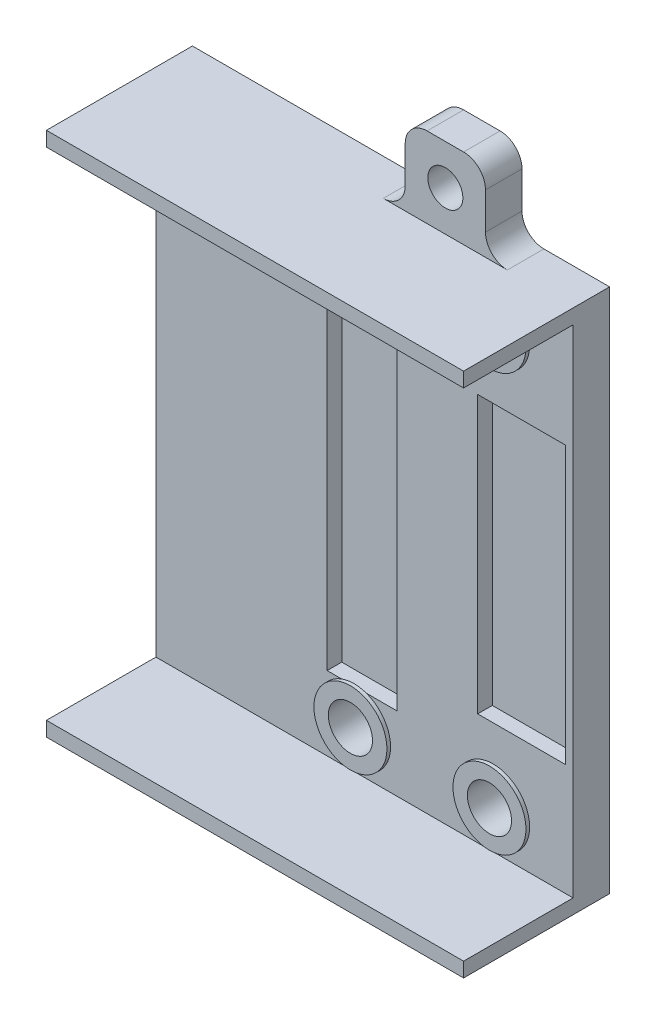
from build123d import *

# Parameters (mm, degrees)
SKETCH3_W            = 57.15
SKETCH3_H            = 72
BOSS_EXTRUDE1_DEPTH  = 5
SKETCH5_R            = 5
SKETCH5_R_2          = 3.025
BOSS_EXTRUDE2_DEPTH  = 0.5
CUT_EXTRUDE1_START   = -4.5
SKETCH6_R            = 3.025
CUT_EXTRUDE1_DEPTH   = 4.5
SKETCH8_W            = 9.600002072
SKETCH8_H            = 47.399999581
CUT_EXTRUDE2_DEPTH   = 2
SKETCH10_W           = 57.15
SKETCH10_H           = 2
BOSS_EXTRUDE3_DEPTH  = 15
SKETCH11_W           = 5.5
SKETCH11_H           = 11
BOSS_EXTRUDE4_DEPTH  = 5
M4_CLEARANCE_HOLE1_D = 4.8
FILLET2_R            = 3


with BuildPart() as part:
    # Sketch3 → Boss-Extrude1 (new body)
    with BuildSketch(Plane.XY):
        Rectangle(SKETCH3_W, SKETCH3_H)
    extrude(amount=BOSS_EXTRUDE1_DEPTH)

    # Sketch5 → Boss-Extrude2 (add)
    # profile 1 of 4: a face of its own
    with BuildSketch(Plane.XY.offset(5)):
        with Locations((17.621, 28.575)):
            Circle(SKETCH5_R)
        with Locations((17.621, 28.575)):
            Circle(SKETCH5_R_2, mode=Mode.SUBTRACT)
    # profile 2 of 4: a face of its own
    with BuildSketch(Plane.XY.offset(5)):
        with Locations((17.621, -28.575)):
            Circle(SKETCH5_R)
        with Locations((17.621, -28.575)):
            Circle(SKETCH5_R_2, mode=Mode.SUBTRACT)
    # profile 3 of 4: a face of its own
    with BuildSketch(Plane.XY.offset(5)):
        with Locations((-1.429, -28.575)):
            Circle(SKETCH5_R)
        with Locations((-1.429, -28.575)):
            Circle(SKETCH5_R_2, mode=Mode.SUBTRACT)
    # profile 4 of 4: a face of its own
    with BuildSketch(Plane.XY.offset(5)):
        with Locations((-1.429, 28.575)):
            Circle(SKETCH5_R)
        with Locations((-1.429, 28.575)):
            Circle(SKETCH5_R_2, mode=Mode.SUBTRACT)
    extrude(amount=BOSS_EXTRUDE2_DEPTH)

    # Sketch6 → Cut-Extrude1 (cut)
    with BuildSketch(Plane.XY.offset(5).offset(CUT_EXTRUDE1_START)):
        with Locations((-1.429, 28.575)):
            Circle(SKETCH6_R)
        with Locations((17.621, 28.575)):
            Circle(SKETCH6_R)
        with Locations((-1.429, -28.575)):
            Circle(SKETCH6_R)
        with Locations((17.621, -28.575)):
            Circle(SKETCH6_R)
    extrude(amount=CUT_EXTRUDE1_DEPTH, mode=Mode.SUBTRACT)

    # Sketch8 → Cut-Extrude2 (cut)
    with BuildSketch(Plane.XY.offset(5)):
        with Locations((-0.315001587, -0.172003205)):
            Rectangle(SKETCH8_W, SKETCH8_H)
        Polygon((15.508001492, 19.203997676), (27.508001492, 19.203997676), (27.508001492, -18.696002324), (15.508003148, -18.696002324), align=None)
    extrude(amount=-CUT_EXTRUDE2_DEPTH, mode=Mode.SUBTRACT)

    # Sketch10 → Boss-Extrude3 (add)
    with BuildSketch(Plane.XY.offset(5)):
        with Locations((0, 35)):
            Rectangle(SKETCH10_W, SKETCH10_H)
        with Locations((0, -35)):
            Rectangle(SKETCH10_W, SKETCH10_H)
    extrude(amount=BOSS_EXTRUDE3_DEPTH)

    # Sketch11 → Boss-Extrude4 (add)
    with BuildSketch(Plane(origin=(0, 0, 0), x_dir=(-1, 0, 0), z_dir=(0, 0, -1))):
        with Locations((-13.825, 41.5)):
            Rectangle(SKETCH11_W, SKETCH11_H)
        with Locations((-8.325, 41.5)):
            Rectangle(SKETCH11_W, SKETCH11_H)
    boss_extrude4 = extrude(amount=-BOSS_EXTRUDE4_DEPTH)

    # M4 Clearance Hole1 (through all)
    with Locations(Plane.XY.offset(5)):
        with Locations((11.075, 41.5)):
            m4_clearance_hole1 = Hole(M4_CLEARANCE_HOLE1_D / 2)

    # Mirror1: Boss-Extrude4, M4 Clearance Hole1 across plane
    add(boss_extrude4.mirror(Plane.ZX))
    add(m4_clearance_hole1.mirror(Plane.ZX), mode=Mode.SUBTRACT)

    # Fillet2
    fillet2_edges = [part.edges().sort_by_distance(p)[0] for p in [
        (5.575, 36, 2.5),
        (16.575, 36, 2.5),
        (16.575, 47, 2.5),
        (5.575, 47, 2.5),
        (16.575, -36, 2.5),
        (5.575, -36, 2.5),
        (5.575, -47, 2.5),
        (16.575, -47, 2.5),
    ]]
    fillet(fillet2_edges, radius=FILLET2_R)


solid = part.part
